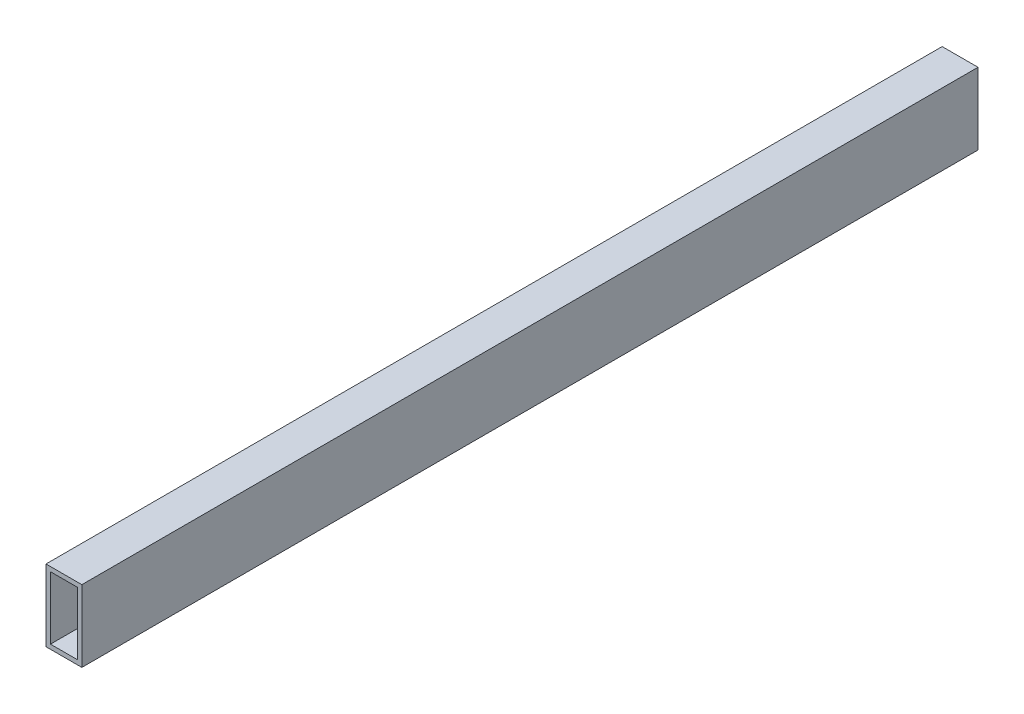
from build123d import *

# Parameters (mm, degrees)
SKETCH1_W           = 25.4
SKETCH1_H           = 50.8
SKETCH1_W_2         = 19.05
SKETCH1_H_2         = 44.45
BOSS_EXTRUDE1_DEPTH = 635


with BuildPart() as part:
    # Sketch1 → Boss-Extrude1 (new body)
    with BuildSketch(Plane.XY):
        with Locations((12.7, 25.4)):
            Rectangle(SKETCH1_W, SKETCH1_H)
        with Locations((12.7, 25.4)):
            Rectangle(SKETCH1_W_2, SKETCH1_H_2, mode=Mode.SUBTRACT)
    extrude(amount=BOSS_EXTRUDE1_DEPTH)


solid = part.part
